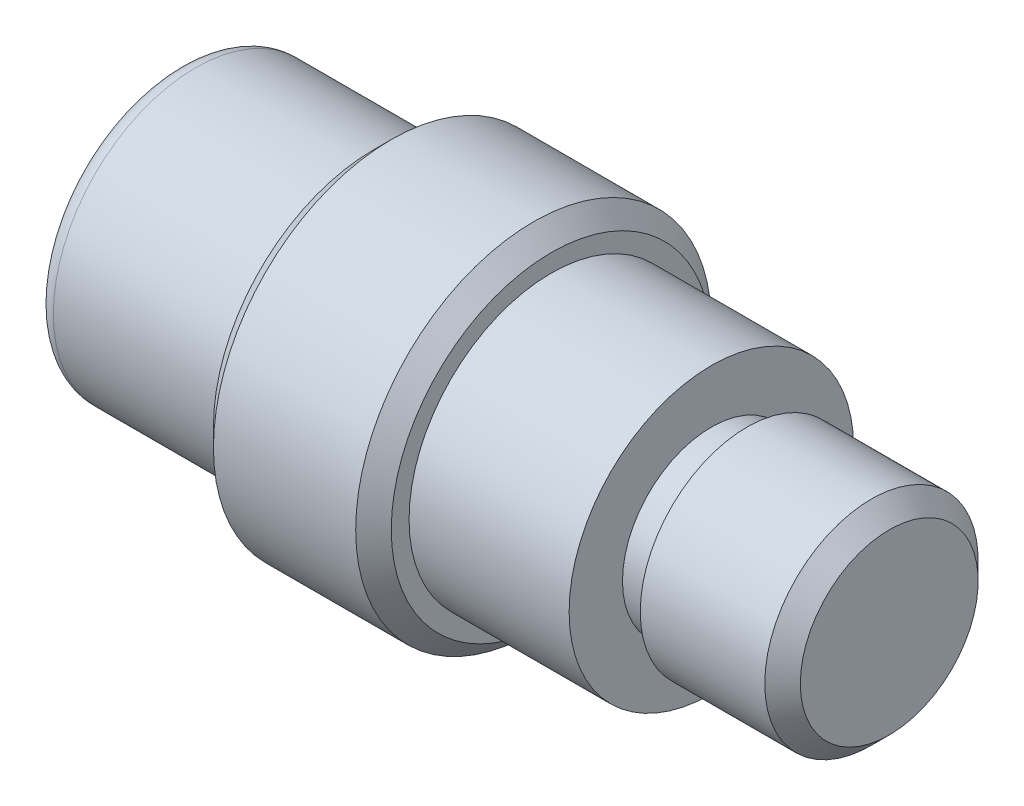
from build123d import *

# Parameters (mm, degrees)
CHAMFER_1_SIZE = 1
CHAMFER_2_SIZE = 1


with BuildPart() as part:
    # 草图1 → 旋转1 (revolve)
    with BuildSketch(Plane.XY, mode=Mode.PRIVATE) as revolve_1_sk:
        with BuildLine():
            Line((0, 0), (0, 7))
            ThreePointArc((0, 7), (0.292893219, 7.707106781), (1, 8))
            Line((1, 8), (11, 8))
            Line((11, 8), (11, 10))
            Line((11, 10), (21, 10))
            Line((21, 10), (21, 8))
            Line((21, 8), (30, 8))
            Line((30, 8), (30, 5))
            Line((30, 5), (32, 5))
            Line((32, 5), (32, 6))
            Line((32, 6), (40, 6))
            Line((40, 6), (40, 0))
            Line((40, 0), (0, 0))
        make_face()
    revolve(revolve_1_sk.sketch.rotate(Axis((0, 0, 0), (1, 0, 0)), 90), axis=Axis((0, 0, 0), (1, 0, 0)))

    # 倒角1
    chamfer_1_edges = [part.edges().sort_by_distance(p)[0] for p in [
        (11, 0, -10),
        (21, 0, -10),
    ]]
    chamfer(chamfer_1_edges, length=CHAMFER_1_SIZE)

    # 倒角2
    chamfer_2_edges = [part.edges().sort_by_distance(p)[0] for p in [
        (40, 0, -6),
    ]]
    chamfer(chamfer_2_edges, length=CHAMFER_2_SIZE)


solid = part.part
